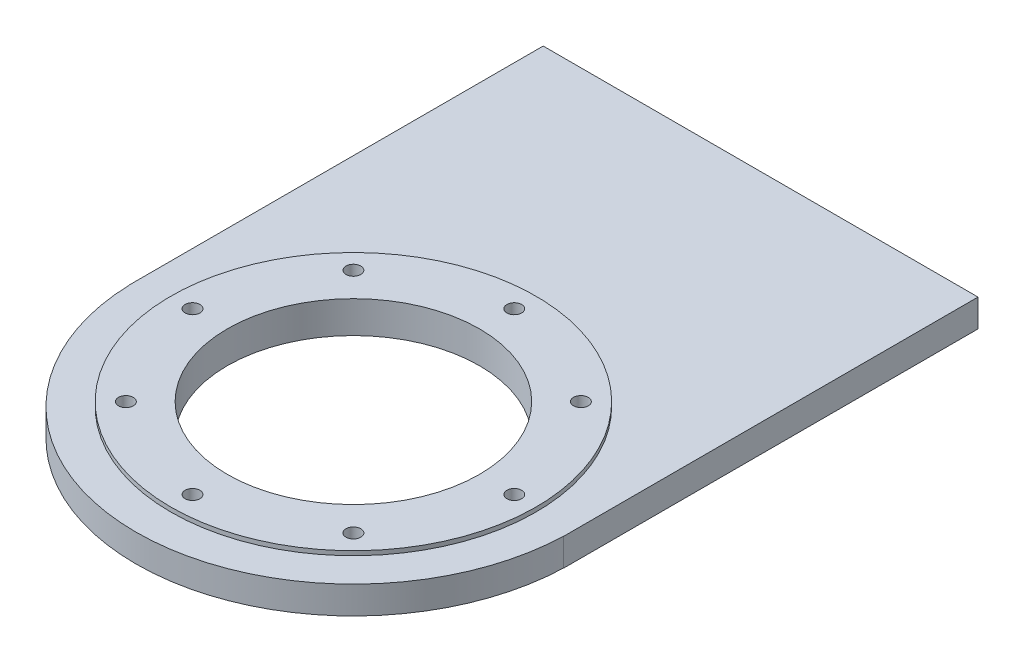
from build123d import *

# Parameters (mm, degrees)
PARED_START                  = -36.1
SK_PARED_W                   = 100
SK_PARED_H                   = 95.3
PARED_DEPTH                  = 6.35
CABEZA_START                 = -36.1
SK_CABEZA_R                  = 50
CABEZA_DEPTH                 = 6.35
ASIENTO_1MM_START            = -29.75
SK_ASIENTO_1MM_R             = 42
SK_ASIENTO_1MM_R_2           = 29
ASIENTO_1MM_DEPTH            = 1
PASO_BOSS_J2_START           = -36.1
SK_PASO_BOSS_J2_R            = 29
PASO_BOSS_J2_DEPTH           = 7.35
PASANTES_M3_ESTATOR_J2_START = -36.1
SK_PASANTES_M3_ESTATOR_J2_R  = 1.7
PASANTES_M3_ESTATOR_J2_DEPTH = 7.35
SK_ROSCA_M3_DESDE_ABAJO_R    = 1.25
ROSCA_M3_DESDE_ABAJO_DEPTH   = 9


with BuildPart() as part:
    # Sk_Pared → Pared (new body)
    with BuildSketch(Plane(origin=(0, 0, 0), x_dir=(1, 0, 0), z_dir=(0, 1, 0)).offset(PARED_START)):
        with Locations((0, -124)):
            Rectangle(SK_PARED_W, SK_PARED_H)
    extrude(amount=PARED_DEPTH)

    # Sk_Cabeza → Cabeza (add)
    with BuildSketch(Plane(origin=(0, 0, 0), x_dir=(1, 0, 0), z_dir=(0, 1, 0)).offset(CABEZA_START)):
        with Locations((0, -170)):
            Circle(SK_CABEZA_R)
    extrude(amount=CABEZA_DEPTH)

    # Sk_Asiento_1mm → Asiento_1mm (add)
    with BuildSketch(Plane(origin=(0, 0, 0), x_dir=(1, 0, 0), z_dir=(0, 1, 0)).offset(ASIENTO_1MM_START)):
        with Locations(Location((0, -170, 0), (0, 0, 270))):
            Circle(SK_ASIENTO_1MM_R)
        with Locations(Location((0, -170, 0), (0, 0, 270))):
            Circle(SK_ASIENTO_1MM_R_2, mode=Mode.SUBTRACT)
    extrude(amount=ASIENTO_1MM_DEPTH)

    # Sk_Paso_boss_J2 → Paso_boss_J2 (cut)
    with BuildSketch(Plane(origin=(0, 0, 0), x_dir=(1, 0, 0), z_dir=(0, 1, 0)).offset(PASO_BOSS_J2_START)):
        with Locations(Location((0, -170, 0), (0, 0, 270))):
            Circle(SK_PASO_BOSS_J2_R)
    extrude(amount=PASO_BOSS_J2_DEPTH, mode=Mode.SUBTRACT)

    # Sk_Pasantes_M3_estator_J2 → Pasantes_M3_estator_J2 (cut)
    with BuildSketch(Plane(origin=(0, 0, 0), x_dir=(1, 0, 0), z_dir=(0, 1, 0)).offset(PASANTES_M3_ESTATOR_J2_START)):
        with Locations(Location((37, -170, 0), (0, 0, 270))):
            Circle(SK_PASANTES_M3_ESTATOR_J2_R)
        with Locations(Location((26.162950904, -196.162950904, 0), (0, 0, 270))):
            Circle(SK_PASANTES_M3_ESTATOR_J2_R)
        with Locations(Location((0, -207, 0), (0, 0, 270))):
            Circle(SK_PASANTES_M3_ESTATOR_J2_R)
        with Locations(Location((-26.162950904, -196.162950904, 0), (0, 0, 270))):
            Circle(SK_PASANTES_M3_ESTATOR_J2_R)
        with Locations(Location((-37, -170, 0), (0, 0, 270))):
            Circle(SK_PASANTES_M3_ESTATOR_J2_R)
        with Locations(Location((-26.162950904, -143.837049096, 0), (0, 0, 270))):
            Circle(SK_PASANTES_M3_ESTATOR_J2_R)
        with Locations(Location((0, -133, 0), (0, 0, 270))):
            Circle(SK_PASANTES_M3_ESTATOR_J2_R)
        with Locations(Location((26.162950904, -143.837049096, 0), (0, 0, 270))):
            Circle(SK_PASANTES_M3_ESTATOR_J2_R)
    extrude(amount=PASANTES_M3_ESTATOR_J2_DEPTH, mode=Mode.SUBTRACT)

    # Sk_Rosca_M3_desde_abajo → Rosca_M3_desde_abajo (cut)
    with BuildSketch(Plane(origin=(0, 0, 76.35), x_dir=(-1, 0, 0), z_dir=(0, 0, -1))):
        with Locations((42, -32.9225)):
            Circle(SK_ROSCA_M3_DESDE_ABAJO_R)
        with Locations((20, -32.9225)):
            Circle(SK_ROSCA_M3_DESDE_ABAJO_R)
        with Locations((-20, -32.9225)):
            Circle(SK_ROSCA_M3_DESDE_ABAJO_R)
        with Locations((-42, -32.9225)):
            Circle(SK_ROSCA_M3_DESDE_ABAJO_R)
    extrude(amount=-ROSCA_M3_DESDE_ABAJO_DEPTH, mode=Mode.SUBTRACT)


solid = part.part
